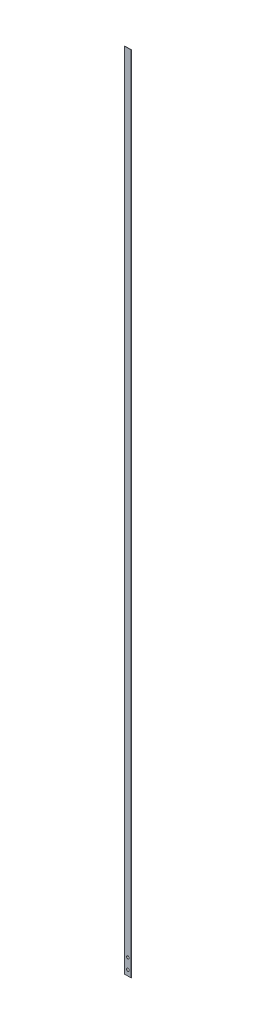
from build123d import *

# Parameters (mm, degrees)
SKETCH1_W           = 5
SKETCH1_H           = 0.2
BOSS_EXTRUDE1_DEPTH = 600
SKETCH2_R           = 1
CUT_EXTRUDE1_DEPTH  = 601.005241644
CUT_EXTRUDE2_REACH  = 602.005
SKETCH3_W           = 5
SKETCH3_H           = 2


with BuildPart() as part:
    # Sketch1 → Boss-Extrude1 (new body)
    with BuildSketch(Plane(origin=(0, 0, 0), x_dir=(1, 0, 0), z_dir=(0, 1, 0))):
        Rectangle(SKETCH1_W, SKETCH1_H)
    extrude(amount=BOSS_EXTRUDE1_DEPTH)

    # Sketch2 → Cut-Extrude1 (cut, through all)
    with BuildSketch(Plane(origin=(0, 0, -0.1), x_dir=(-1, 0, 0), z_dir=(0, 0, -1))):
        with Locations((0, 14)):
            Circle(SKETCH2_R)
        with Locations((0, 6)):
            Circle(SKETCH2_R)
    extrude(amount=-CUT_EXTRUDE1_DEPTH, mode=Mode.SUBTRACT)

    # Sketch3 → Cut-Extrude2 (cut, up to next)
    with BuildSketch(Plane.XY.offset(0.1), mode=Mode.PRIVATE) as cut_extrude2_sk1:
        with Locations((0, 1)):
            Rectangle(SKETCH3_W, SKETCH3_H)
    cut_extrude2_tool1 = extrude(cut_extrude2_sk1.sketch, amount=-CUT_EXTRUDE2_REACH, mode=Mode.PRIVATE) & part.part
    add(cut_extrude2_tool1.solids().sort_by_distance((0, 1, 0.1))[0], mode=Mode.SUBTRACT)


solid = part.part
